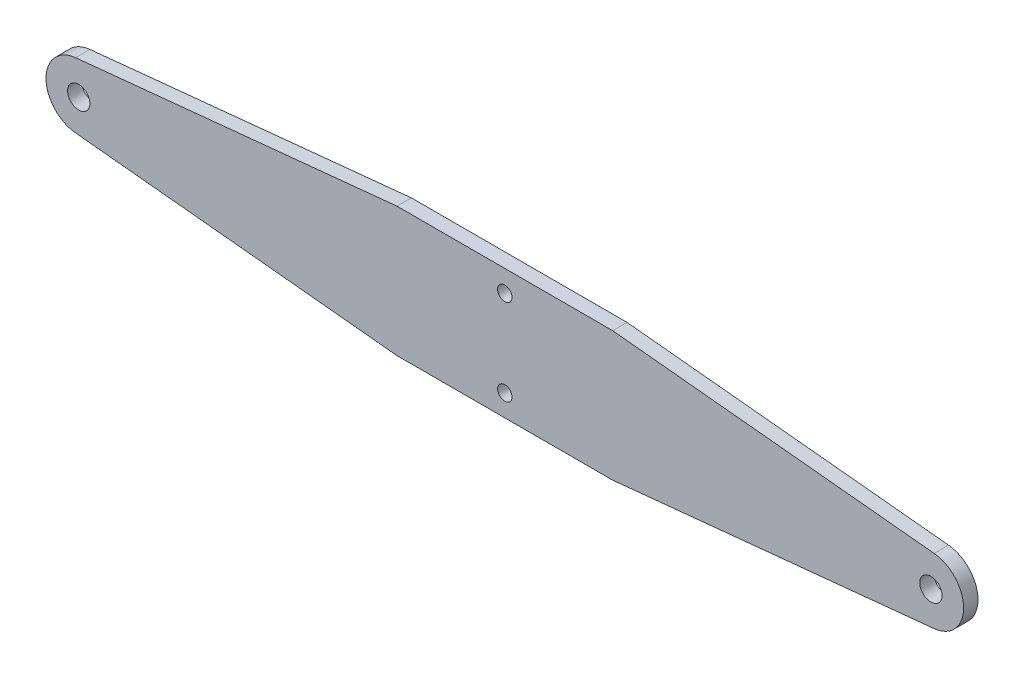
from build123d import *

# Parameters (mm, degrees)
SKETCH1_R           = 1.55
SKETCH1_R_2         = 1
BOSS_EXTRUDE1_DEPTH = 2


with BuildPart() as part:
    # Sketch1 → Boss-Extrude1 (new body)
    with BuildSketch(Plane.XY):
        with BuildLine():
            Line((15, -9), (-15, -9))
            Line((-15, -9), (-59.702973214, -4.52739608))
            ThreePointArc((-59.702973214, -4.52739608), (-63.8, 0), (-59.702973214, 4.52739608))
            Line((-59.702973214, 4.52739608), (-15, 9))
            Line((-15, 9), (15, 9))
            Line((15, 9), (59.702973214, 4.52739608))
            ThreePointArc((59.702973214, 4.52739608), (63.8, 0), (59.702973214, -4.52739608))
            Line((59.702973214, -4.52739608), (15, -9))
        make_face()
        with Locations((-59.25, 0)):
            Circle(SKETCH1_R, mode=Mode.SUBTRACT)
        with Locations((59.25, 0)):
            Circle(SKETCH1_R, mode=Mode.SUBTRACT)
        with Locations((0, -6)):
            Circle(SKETCH1_R_2, mode=Mode.SUBTRACT)
        with Locations(Location((0, 6, 0), (0, 0, 180))):
            Circle(SKETCH1_R_2, mode=Mode.SUBTRACT)
    extrude(amount=BOSS_EXTRUDE1_DEPTH)


solid = part.part
